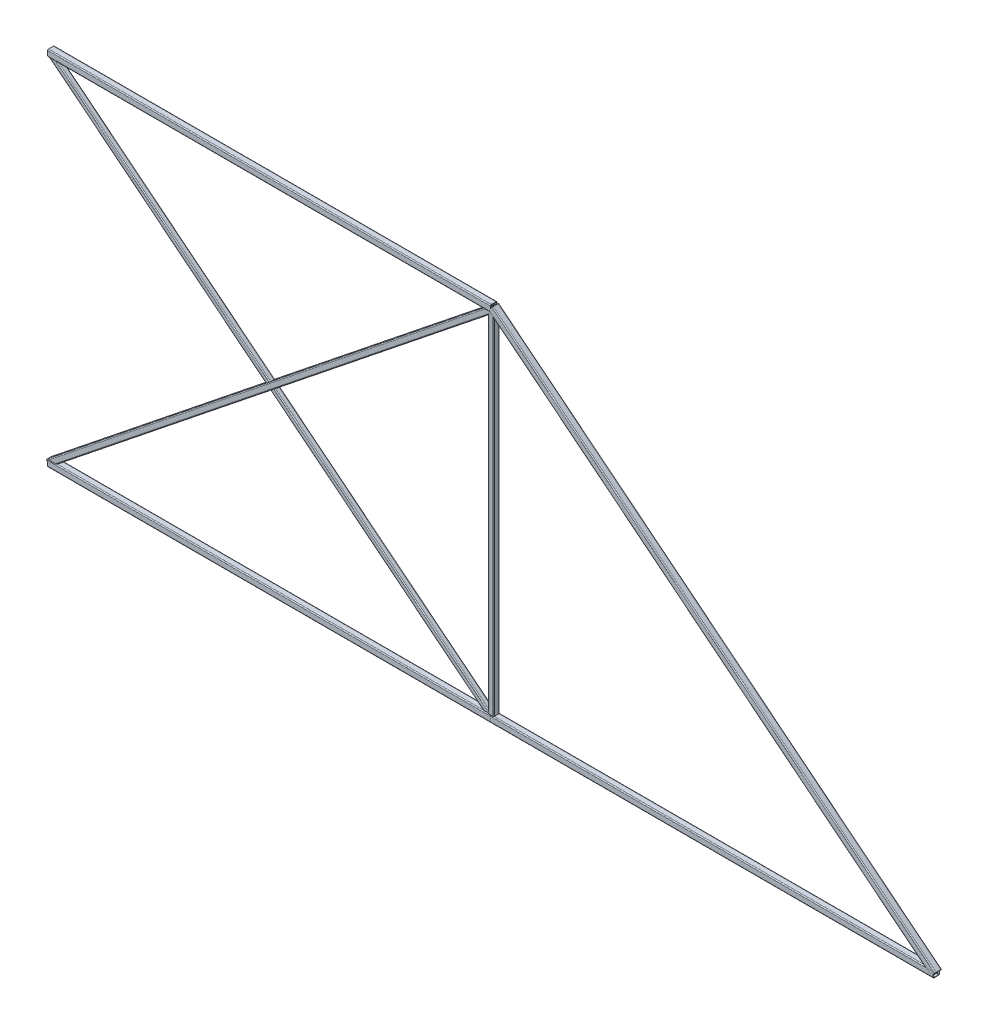
from build123d import *

# Parameters (mm, degrees)
ELEMENT_1_DEPTH = 6096
ELEMENT_2_DEPTH = 6096
ELEMENT_3_DEPTH = 6096
ELEMENT_4_DEPTH = 7806.689070278
ELEMENT_5_DEPTH = 7816.00479415
ELEMENT_6_DEPTH = 4876.8
ELEMENT_7_DEPTH = 7816.00479415


with BuildPart() as part:
    # Sketch13 → element 1 (new body)
    with BuildSketch(Plane.YZ):
        with BuildLine():
            Line((-32.6136, -45.3136), (32.6136, -45.3136))
            ThreePointArc((32.6136, -45.3136), (41.593856121, -41.593856121), (45.3136, -32.6136))
            Line((45.3136, -32.6136), (45.3136, 32.6136))
            ThreePointArc((45.3136, 32.6136), (41.593856121, 41.593856121), (32.6136, 45.3136))
            Line((32.6136, 45.3136), (-32.6136, 45.3136))
            ThreePointArc((-32.6136, 45.3136), (-41.593856121, 41.593856121), (-45.3136, 32.6136))
            Line((-45.3136, 32.6136), (-45.3136, -32.6136))
            ThreePointArc((-45.3136, -32.6136), (-41.593856121, -41.593856121), (-32.6136, -45.3136))
        make_face()
        with BuildLine():
            Line((-32.6136, -38.9636), (32.6136, -38.9636))
            ThreePointArc((32.6136, -38.9636), (37.103728061, -37.103728061), (38.9636, -32.6136))
            Line((38.9636, -32.6136), (38.9636, 32.6136))
            ThreePointArc((38.9636, 32.6136), (37.103728061, 37.103728061), (32.6136, 38.9636))
            Line((32.6136, 38.9636), (-32.6136, 38.9636))
            ThreePointArc((-32.6136, 38.9636), (-37.103728061, 37.103728061), (-38.9636, 32.6136))
            Line((-38.9636, 32.6136), (-38.9636, -32.6136))
            ThreePointArc((-38.9636, -32.6136), (-37.103728061, -37.103728061), (-32.6136, -38.9636))
        make_face(mode=Mode.SUBTRACT)
    extrude(amount=ELEMENT_1_DEPTH)


with BuildPart() as body_2:
    # Sketch15 → element 2 (new body)
    with BuildSketch(Plane(origin=(12192, 0, 0), x_dir=(0, -1, 0), z_dir=(-1, 0, 0))):
        with BuildLine():
            Line((-32.6136, -45.3136), (32.6136, -45.3136))
            ThreePointArc((32.6136, -45.3136), (41.593856121, -41.593856121), (45.3136, -32.6136))
            Line((45.3136, -32.6136), (45.3136, 32.6136))
            ThreePointArc((45.3136, 32.6136), (41.593856121, 41.593856121), (32.6136, 45.3136))
            Line((32.6136, 45.3136), (-32.6136, 45.3136))
            ThreePointArc((-32.6136, 45.3136), (-41.593856121, 41.593856121), (-45.3136, 32.6136))
            Line((-45.3136, 32.6136), (-45.3136, -32.6136))
            ThreePointArc((-45.3136, -32.6136), (-41.593856121, -41.593856121), (-32.6136, -45.3136))
        make_face()
        with BuildLine():
            Line((-32.6136, -38.9636), (32.6136, -38.9636))
            ThreePointArc((32.6136, -38.9636), (37.103728061, -37.103728061), (38.9636, -32.6136))
            Line((38.9636, -32.6136), (38.9636, 32.6136))
            ThreePointArc((38.9636, 32.6136), (37.103728061, 37.103728061), (32.6136, 38.9636))
            Line((32.6136, 38.9636), (-32.6136, 38.9636))
            ThreePointArc((-32.6136, 38.9636), (-37.103728061, 37.103728061), (-38.9636, 32.6136))
            Line((-38.9636, 32.6136), (-38.9636, -32.6136))
            ThreePointArc((-38.9636, -32.6136), (-37.103728061, -37.103728061), (-32.6136, -38.9636))
        make_face(mode=Mode.SUBTRACT)
    extrude(amount=ELEMENT_2_DEPTH)


with BuildPart() as body_3:
    # Sketch17 → element 3 (new body)
    with BuildSketch(Plane(origin=(0, 4891.698574338, 0), x_dir=(0, 1, 0), z_dir=(1, 0, 0))):
        with BuildLine():
            Line((-32.6136, -45.3136), (32.6136, -45.3136))
            ThreePointArc((32.6136, -45.3136), (41.593856121, -41.593856121), (45.3136, -32.6136))
            Line((45.3136, -32.6136), (45.3136, 32.6136))
            ThreePointArc((45.3136, 32.6136), (41.593856121, 41.593856121), (32.6136, 45.3136))
            Line((32.6136, 45.3136), (-32.6136, 45.3136))
            ThreePointArc((-32.6136, 45.3136), (-41.593856121, 41.593856121), (-45.3136, 32.6136))
            Line((-45.3136, 32.6136), (-45.3136, -32.6136))
            ThreePointArc((-45.3136, -32.6136), (-41.593856121, -41.593856121), (-32.6136, -45.3136))
        make_face()
        with BuildLine():
            Line((-32.6136, -38.9636), (32.6136, -38.9636))
            ThreePointArc((32.6136, -38.9636), (37.103728061, -37.103728061), (38.9636, -32.6136))
            Line((38.9636, -32.6136), (38.9636, 32.6136))
            ThreePointArc((38.9636, 32.6136), (37.103728061, 37.103728061), (32.6136, 38.9636))
            Line((32.6136, 38.9636), (-32.6136, 38.9636))
            ThreePointArc((-32.6136, 38.9636), (-37.103728061, 37.103728061), (-38.9636, 32.6136))
            Line((-38.9636, 32.6136), (-38.9636, -32.6136))
            ThreePointArc((-38.9636, -32.6136), (-37.103728061, -37.103728061), (-32.6136, -38.9636))
        make_face(mode=Mode.SUBTRACT)
    extrude(amount=ELEMENT_3_DEPTH)


with BuildPart() as body_4:
    # Sketch19 → element 4 (new body)
    with BuildSketch(Plane(origin=(0, 0, 0), x_dir=(-0.6246950475544243, 0.7808688094430304, 0), z_dir=(0.7808688094430304, 0.6246950475544243, 0))):
        with BuildLine():
            Line((-27.8384, -40.5384), (27.8384, -40.5384))
            ThreePointArc((27.8384, -40.5384), (36.818656121, -36.818656121), (40.5384, -27.8384))
            Line((40.5384, -27.8384), (40.5384, 27.8384))
            ThreePointArc((40.5384, 27.8384), (36.818656121, 36.818656121), (27.8384, 40.5384))
            Line((27.8384, 40.5384), (-27.8384, 40.5384))
            ThreePointArc((-27.8384, 40.5384), (-36.818656121, 36.818656121), (-40.5384, 27.8384))
            Line((-40.5384, 27.8384), (-40.5384, -27.8384))
            ThreePointArc((-40.5384, -27.8384), (-36.818656121, -36.818656121), (-27.8384, -40.5384))
        make_face()
        with BuildLine():
            Line((-27.8384, -34.1884), (27.8384, -34.1884))
            ThreePointArc((27.8384, -34.1884), (32.328528061, -32.328528061), (34.1884, -27.8384))
            Line((34.1884, -27.8384), (34.1884, 27.8384))
            ThreePointArc((34.1884, 27.8384), (32.328528061, 32.328528061), (27.8384, 34.1884))
            Line((27.8384, 34.1884), (-27.8384, 34.1884))
            ThreePointArc((-27.8384, 34.1884), (-32.328528061, 32.328528061), (-34.1884, 27.8384))
            Line((-34.1884, 27.8384), (-34.1884, -27.8384))
            ThreePointArc((-34.1884, -27.8384), (-32.328528061, -32.328528061), (-27.8384, -34.1884))
        make_face(mode=Mode.SUBTRACT)
    extrude(amount=ELEMENT_4_DEPTH)


with BuildPart() as body_5:
    # Sketch18 → element 5 (new body)
    with BuildSketch(Plane(origin=(0, 4891.698574338, 0), x_dir=(0.625856649678507, 0.779938109117124, 0), z_dir=(0.779938109117124, -0.625856649678507, 0))):
        with BuildLine():
            Line((-22.4028, -35.1028), (22.4028, -35.1028))
            ThreePointArc((22.4028, -35.1028), (31.383056121, -31.383056121), (35.1028, -22.4028))
            Line((35.1028, -22.4028), (35.1028, 22.4028))
            ThreePointArc((35.1028, 22.4028), (31.383056121, 31.383056121), (22.4028, 35.1028))
            Line((22.4028, 35.1028), (-22.4028, 35.1028))
            ThreePointArc((-22.4028, 35.1028), (-31.383056121, 31.383056121), (-35.1028, 22.4028))
            Line((-35.1028, 22.4028), (-35.1028, -22.4028))
            ThreePointArc((-35.1028, -22.4028), (-31.383056121, -31.383056121), (-22.4028, -35.1028))
        make_face()
        with BuildLine():
            Line((-22.4028, -28.7528), (22.4028, -28.7528))
            ThreePointArc((22.4028, -28.7528), (26.892928061, -26.892928061), (28.7528, -22.4028))
            Line((28.7528, -22.4028), (28.7528, 22.4028))
            ThreePointArc((28.7528, 22.4028), (26.892928061, 26.892928061), (22.4028, 28.7528))
            Line((22.4028, 28.7528), (-22.4028, 28.7528))
            ThreePointArc((-22.4028, 28.7528), (-26.892928061, 26.892928061), (-28.7528, 22.4028))
            Line((-28.7528, 22.4028), (-28.7528, -22.4028))
            ThreePointArc((-28.7528, -22.4028), (-26.892928061, -26.892928061), (-22.4028, -28.7528))
        make_face(mode=Mode.SUBTRACT)
    extrude(amount=ELEMENT_5_DEPTH)


with BuildPart() as body_6:
    # Sketch110 → element 6 (new body)
    with BuildSketch(Plane(origin=(6096, 4876.8, 0), x_dir=(1, 0, 0), z_dir=(0, -1, 0))):
        with BuildLine():
            Line((-27.8384, -40.5384), (27.8384, -40.5384))
            ThreePointArc((27.8384, -40.5384), (36.818656121, -36.818656121), (40.5384, -27.8384))
            Line((40.5384, -27.8384), (40.5384, 27.8384))
            ThreePointArc((40.5384, 27.8384), (36.818656121, 36.818656121), (27.8384, 40.5384))
            Line((27.8384, 40.5384), (-27.8384, 40.5384))
            ThreePointArc((-27.8384, 40.5384), (-36.818656121, 36.818656121), (-40.5384, 27.8384))
            Line((-40.5384, 27.8384), (-40.5384, -27.8384))
            ThreePointArc((-40.5384, -27.8384), (-36.818656121, -36.818656121), (-27.8384, -40.5384))
        make_face()
        with BuildLine():
            Line((-27.8384, -34.1884), (27.8384, -34.1884))
            ThreePointArc((27.8384, -34.1884), (32.328528061, -32.328528061), (34.1884, -27.8384))
            Line((34.1884, -27.8384), (34.1884, 27.8384))
            ThreePointArc((34.1884, 27.8384), (32.328528061, 32.328528061), (27.8384, 34.1884))
            Line((27.8384, 34.1884), (-27.8384, 34.1884))
            ThreePointArc((-27.8384, 34.1884), (-32.328528061, 32.328528061), (-34.1884, 27.8384))
            Line((-34.1884, 27.8384), (-34.1884, -27.8384))
            ThreePointArc((-34.1884, -27.8384), (-32.328528061, -32.328528061), (-27.8384, -34.1884))
        make_face(mode=Mode.SUBTRACT)
    extrude(amount=ELEMENT_6_DEPTH)


with BuildPart() as body_7:
    # Sketch16 → element 7 (new body)
    with BuildSketch(Plane(origin=(6096, 4891.698574338, 0), x_dir=(0.625856649678507, 0.779938109117124, 0), z_dir=(0.779938109117124, -0.625856649678507, 0))):
        with BuildLine():
            Line((-32.6136, -45.3136), (32.6136, -45.3136))
            ThreePointArc((32.6136, -45.3136), (41.593856121, -41.593856121), (45.3136, -32.6136))
            Line((45.3136, -32.6136), (45.3136, 32.6136))
            ThreePointArc((45.3136, 32.6136), (41.593856121, 41.593856121), (32.6136, 45.3136))
            Line((32.6136, 45.3136), (-32.6136, 45.3136))
            ThreePointArc((-32.6136, 45.3136), (-41.593856121, 41.593856121), (-45.3136, 32.6136))
            Line((-45.3136, 32.6136), (-45.3136, -32.6136))
            ThreePointArc((-45.3136, -32.6136), (-41.593856121, -41.593856121), (-32.6136, -45.3136))
        make_face()
        with BuildLine():
            Line((-32.6136, -38.9636), (32.6136, -38.9636))
            ThreePointArc((32.6136, -38.9636), (37.103728061, -37.103728061), (38.9636, -32.6136))
            Line((38.9636, -32.6136), (38.9636, 32.6136))
            ThreePointArc((38.9636, 32.6136), (37.103728061, 37.103728061), (32.6136, 38.9636))
            Line((32.6136, 38.9636), (-32.6136, 38.9636))
            ThreePointArc((-32.6136, 38.9636), (-37.103728061, 37.103728061), (-38.9636, 32.6136))
            Line((-38.9636, 32.6136), (-38.9636, -32.6136))
            ThreePointArc((-38.9636, -32.6136), (-37.103728061, -37.103728061), (-32.6136, -38.9636))
        make_face(mode=Mode.SUBTRACT)
    extrude(amount=ELEMENT_7_DEPTH)


solid = Compound([part.part, body_2.part, body_3.part, body_4.part, body_5.part, body_6.part, body_7.part])
